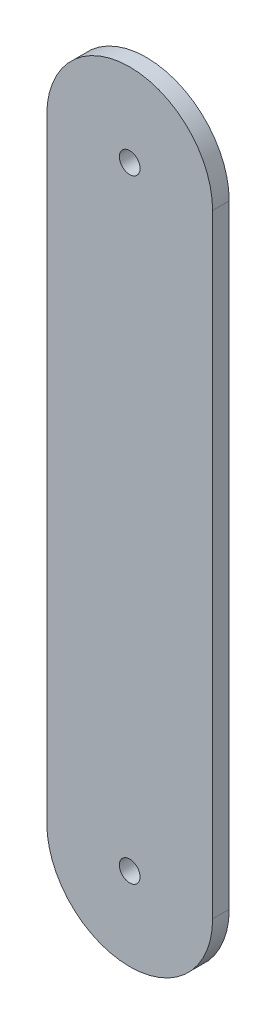
from build123d import *

# Parameters (mm, degrees)
SKETCH_1_R      = 1.25
EXTRUDE_1_DEPTH = 2


with BuildPart() as part:
    # 草圖1 → 填料-伸長1 (new body)
    with BuildSketch(Plane.XY):
        with BuildLine():
            Line((-28.683379048, 42.256823821), (-28.683379048, -31.743176179))
            ThreePointArc((-28.683379048, -31.743176179), (-18.683379048, -41.743176179), (-8.683379048, -31.743176179))
            Line((-8.683379048, -31.743176179), (-8.683379048, 42.256823821))
            ThreePointArc((-8.683379048, 42.256823821), (-18.683379048, 52.256823821), (-28.683379048, 42.256823821))
        make_face()
        with Locations((-18.683379048, 42.256823821)):
            Circle(SKETCH_1_R, mode=Mode.SUBTRACT)
        with Locations((-18.683379048, -31.743176179)):
            Circle(SKETCH_1_R, mode=Mode.SUBTRACT)
    extrude(amount=EXTRUDE_1_DEPTH)


solid = part.part
